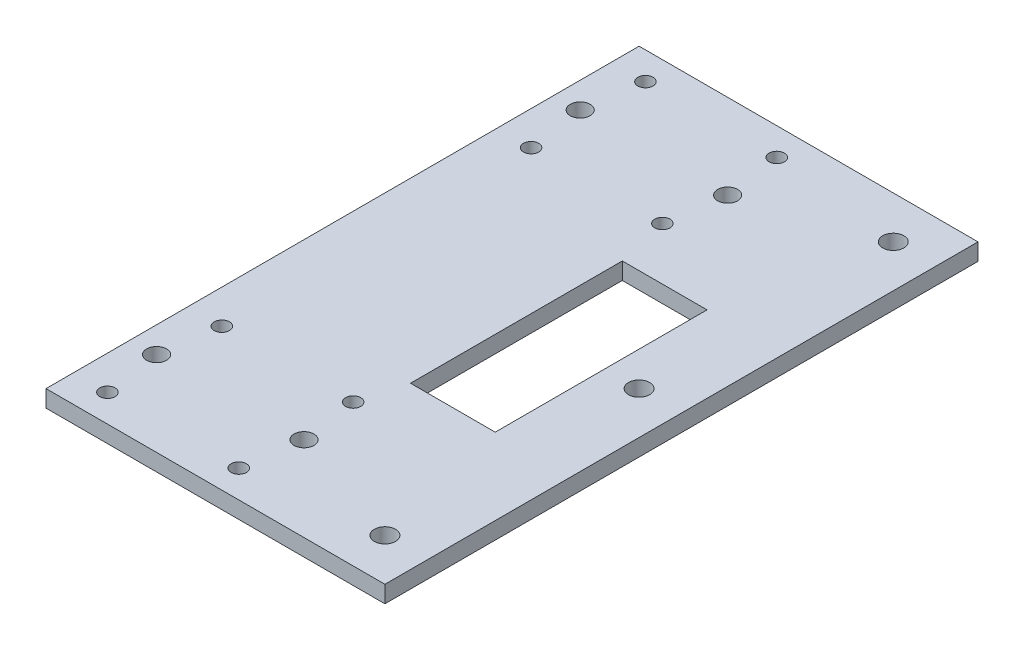
from build123d import *

# Parameters (mm, degrees)
SKETCH_2_W          = 80
SKETCH_2_H          = 140
EXTRUDE_1_DEPTH     = 4
SKETCH_3_R          = 1.8
SKETCH_3_R_2        = 2.35
SKETCH_3_R_3        = 2.5
CUT_EXTRUDE_3_DEPTH = 4
CUT_EXTRUDE_4_REACH = 108.377
SKETCH_4_W          = 20
SKETCH_4_H          = 50


with BuildPart() as part:
    # 草图2 → 凸台-拉伸1 (new body)
    with BuildSketch(Plane(origin=(0, 0, 0), x_dir=(1, 0, 0), z_dir=(0, 1, 0))):
        with Locations((-40, 0)):
            Rectangle(SKETCH_2_W, SKETCH_2_H)
    extrude(amount=EXTRUDE_1_DEPTH)

    # 草图3 → 切除-拉伸3 (cut)
    with BuildSketch(Plane(origin=(0, 4, 0), x_dir=(1, 0, 0), z_dir=(0, 1, 0))):
        with Locations(Location((-72, 63.5, 0), (0, 0, 270))):
            Circle(SKETCH_3_R)
        with Locations(Location((-41, 63.5, 0), (0, 0, 270))):
            Circle(SKETCH_3_R)
        with Locations(Location((-41, 36.5, 0), (0, 0, 270))):
            Circle(SKETCH_3_R)
        with Locations(Location((-72, 36.5, 0), (0, 0, 270))):
            Circle(SKETCH_3_R)
        with Locations(Location((-41, -63.5, 0), (0, 0, 270))):
            Circle(SKETCH_3_R)
        with Locations(Location((-41, -36.5, 0), (0, 0, 270))):
            Circle(SKETCH_3_R)
        with Locations(Location((-72, -36.5, 0), (0, 0, 270))):
            Circle(SKETCH_3_R)
        with Locations(Location((-72, -63.5, 0), (0, 0, 270))):
            Circle(SKETCH_3_R)
        with Locations(Location((-73.9, 50, 0), (0, 0, 270))):
            Circle(SKETCH_3_R_2)
        with Locations(Location((-73.9, -50, 0), (0, 0, 270))):
            Circle(SKETCH_3_R_2)
        with Locations(Location((-39.1, -50, 0), (0, 0, 270))):
            Circle(SKETCH_3_R_2)
        with Locations(Location((-39.1, 50, 0), (0, 0, 270))):
            Circle(SKETCH_3_R_2)
        with Locations(Location((-10, 60, 0), (0, 0, 270))):
            Circle(SKETCH_3_R_3)
        with Locations(Location((-10, 0, 0), (0, 0, 270))):
            Circle(SKETCH_3_R_3)
        with Locations(Location((-10, -60, 0), (0, 0, 270))):
            Circle(SKETCH_3_R_3)
    extrude(amount=-CUT_EXTRUDE_3_DEPTH, mode=Mode.SUBTRACT)

    # 草图4 → 切除-拉伸4 (cut, up to next)
    with BuildSketch(Plane.XZ, mode=Mode.PRIVATE) as cut_extrude_4_sk1:
        with Locations((-28.074591113, 0.884472787)):
            Rectangle(SKETCH_4_W, SKETCH_4_H)
    cut_extrude_4_tool1 = extrude(cut_extrude_4_sk1.sketch, amount=-CUT_EXTRUDE_4_REACH, mode=Mode.PRIVATE) & part.part
    add(cut_extrude_4_tool1.solids().sort_by_distance((-28.074591, 0, 0.884473))[0], mode=Mode.SUBTRACT)


solid = part.part
